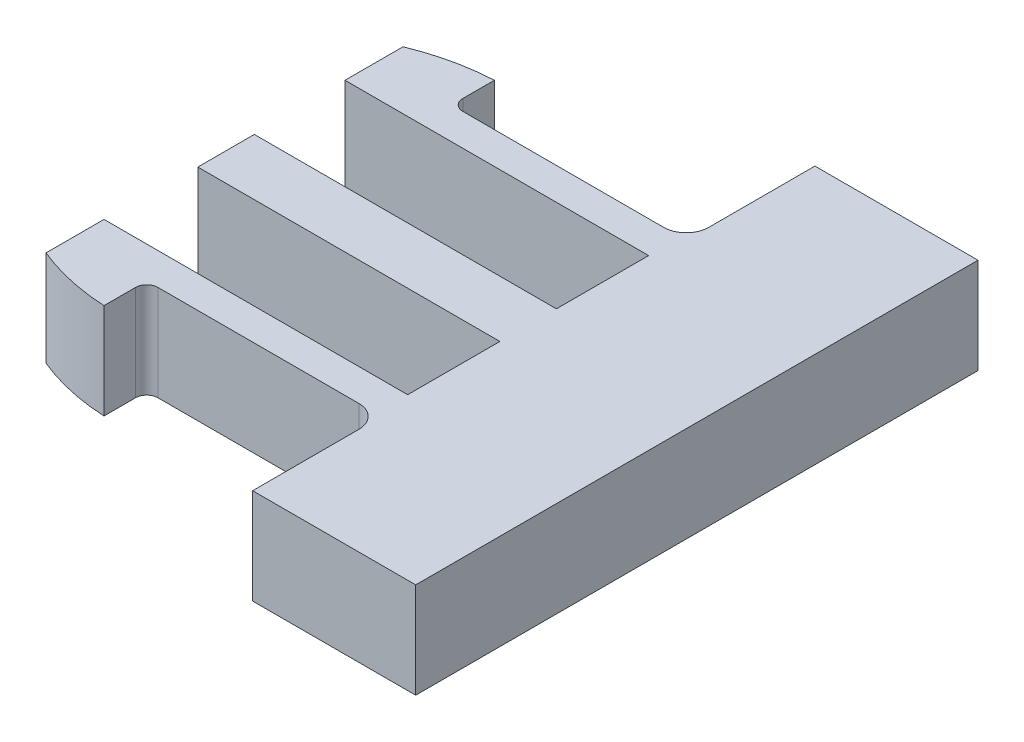
from build123d import *

# Parameters (mm, degrees)
SALIENTE_EXTRUIR1_DEPTH = 8.5
REDONDEO1_R             = 2
CORTAR_EXTRUIR1_START   = -10
CORTAR_EXTRUIR1_DEPTH   = 10
CROQUIS3_W              = 2
CROQUIS3_H              = 37.641018094
CORTAR_EXTRUIR2_DEPTH   = 10
CROQUIS4_W              = 20.360825868
CROQUIS4_H              = 3.8
CORTAR_EXTRUIR3_DEPTH   = 10
REDONDEO2_R             = 1
REDONDEO3_R             = 2
CORTAR_EXTRUIR4_DEPTH   = 10
CORTAR_EXTRUIR5_DEPTH   = 10
REDONDEO4_R             = 2
CROQUIS9_W              = 0.360825868
CROQUIS9_H              = 41.677341087
CORTAR_EXTRUIR6_DEPTH   = 10
CROQUIS10_W             = 14.5
CROQUIS10_H             = 0.285488866
SALIENTE_EXTRUIR2_DEPTH = 8.5


with BuildPart() as part:
    # Croquis1 → Saliente-Extruir1 (new body)
    with BuildSketch(Plane(origin=(0, 0, 0), x_dir=(1, 0, 0), z_dir=(0, 1, 0))):
        with BuildLine():
            Line((13.270197773, -14.714511134), (13.270197773, -24.714511134))
            Line((13.270197773, -24.714511134), (28.270197773, -24.714511134))
            Line((28.270197773, -24.714511134), (28.270197773, 24.714511134))
            Line((28.270197773, 24.714511134), (13.270197773, 24.714511134))
            Line((13.270197773, 24.714511134), (13.270197773, 14.714511134))
            Line((13.270197773, 14.714511134), (-6.590628095, 14.714511134))
            ThreePointArc((-6.590628095, 14.714511134), (-6.944181486, 14.860957744), (-7.090628095, 15.214511134))
            Line((-7.090628095, 15.214511134), (-7.090628095, 18.995462915))
            ThreePointArc((-7.090628095, 18.995462915), (-7.383521314, 19.702569696), (-8.090628095, 19.995462915))
            ThreePointArc((-8.090628095, 19.995462915), (-12.706365951, 18.287755027), (-16.090628095, 14.714511134))
            Line((-16.090628095, 14.714511134), (-16.090628095, 10.714511134))
            Line((-16.090628095, 10.714511134), (13.270197773, 10.714511134))
            Line((13.270197773, 10.714511134), (13.270197773, 8.214511134))
            Line((13.270197773, 8.214511134), (13.270197773, 5.212235466))
            Line((13.270197773, 5.212235466), (13.270197773, 5.012235466))
            Line((13.270197773, 5.012235466), (13.270197773, 3.012235466))
            Line((13.270197773, 3.012235466), (-16.090628095, 3.012235466))
            Line((-16.090628095, 3.012235466), (-16.090628095, -3.012235466))
            Line((-16.090628095, -3.012235466), (13.270197773, -3.012235466))
            Line((13.270197773, -3.012235466), (13.270197773, -5.012235466))
            Line((13.270197773, -5.012235466), (13.270197773, -5.212235466))
            Line((13.270197773, -5.212235466), (13.270197773, -8.214511134))
            Line((13.270197773, -8.214511134), (13.270197773, -10.714511134))
            Line((13.270197773, -10.714511134), (-16.090628095, -10.714511134))
            Line((-16.090628095, -10.714511134), (-16.090628095, -14.714511134))
            ThreePointArc((-16.090628095, -14.714511134), (-12.706365951, -18.287755027), (-8.090628095, -19.995462915))
            ThreePointArc((-8.090628095, -19.995462915), (-7.383521314, -19.702569696), (-7.090628095, -18.995462915))
            Line((-7.090628095, -18.995462915), (-7.090628095, -14.714511134))
            Line((-7.090628095, -14.714511134), (13.270197773, -14.714511134))
        make_face()
    extrude(amount=SALIENTE_EXTRUIR1_DEPTH)

    # Redondeo1
    redondeo1_edges = [part.edges().sort_by_distance(p)[0] for p in [
        (13.270197773, 4.25, -14.714511134),
        (13.270197773, 4.25, 14.714511134),
    ]]
    fillet(redondeo1_edges, radius=REDONDEO1_R)

    # Croquis2 → Cortar-Extruir1 (cut)
    with BuildSketch(Plane(origin=(0, 8.5, 0), x_dir=(1, 0, 0), z_dir=(0, 1, 0)).offset(CORTAR_EXTRUIR1_START)):
        with BuildLine():
            Line((-7.090628095, 18.995462915), (-7.090628095, 17.354987025))
            ThreePointArc((-7.090628095, 17.354987025), (-11.747603416, 16.569795769), (-16.090628095, 14.714511134))
            ThreePointArc((-16.090628095, 14.714511134), (-12.706365951, 18.287755027), (-8.090628095, 19.995462915))
            ThreePointArc((-8.090628095, 19.995462915), (-7.383521314, 19.702569696), (-7.090628095, 18.995462915))
        make_face()
        with BuildLine():
            Line((-7.090628095, -18.995462915), (-7.090628095, -17.354987025))
            ThreePointArc((-7.090628095, -17.354987025), (-11.747603416, -16.569795769), (-16.090628095, -14.714511134))
            ThreePointArc((-16.090628095, -14.714511134), (-12.706365951, -18.287755027), (-8.090628095, -19.995462915))
            ThreePointArc((-8.090628095, -19.995462915), (-7.383521314, -19.702569696), (-7.090628095, -18.995462915))
        make_face()
    extrude(amount=CORTAR_EXTRUIR1_DEPTH, mode=Mode.SUBTRACT)

    # Croquis3 → Cortar-Extruir2 (cut)
    with BuildSketch(Plane(origin=(0, 8.5, 0), x_dir=(1, 0, 0), z_dir=(0, 1, 0))):
        with Locations((-15.090628095, -0.838537532)):
            Rectangle(CROQUIS3_W, CROQUIS3_H)
    extrude(amount=-CORTAR_EXTRUIR2_DEPTH, mode=Mode.SUBTRACT)

    # Croquis4 → Cortar-Extruir3 (cut)
    with BuildSketch(Plane(origin=(0, 8.5, 0), x_dir=(1, 0, 0), z_dir=(0, 1, 0))):
        with Locations((3.089784839, 15.454987025)):
            Rectangle(CROQUIS4_W, CROQUIS4_H)
        with Locations((3.089784839, -15.454987025)):
            Rectangle(CROQUIS4_W, CROQUIS4_H)
    extrude(amount=-CORTAR_EXTRUIR3_DEPTH, mode=Mode.SUBTRACT)

    # Redondeo2
    redondeo2_edges = [part.edges().sort_by_distance(p)[0] for p in [
        (-7.090628095, 4.25, -13.554987025),
        (-7.090628095, 4.25, 13.554987025),
    ]]
    fillet(redondeo2_edges, radius=REDONDEO2_R)

    # Redondeo3
    redondeo3_edges = [part.edges().sort_by_distance(p)[0] for p in [
        (13.270197773, 4.25, -13.554987025),
        (13.270197773, 4.25, 13.554987025),
    ]]
    fillet(redondeo3_edges, radius=REDONDEO3_R)

    # Croquis6 → Cortar-Extruir4 (cut)
    with BuildSketch(Plane(origin=(0, 8.5, 0), x_dir=(1, 0, 0), z_dir=(0, 1, 0))):
        Polygon((-14.090628095, -3.012235466), (13.270197773, -3.012235466), (13.270197773, -2.512235466), (-13.590628095, -2.512235466), (-13.590628095, 2.512235466), (13.270197773, 2.512235466), (13.270197773, 3.012235466), (-14.090628095, 3.012235466), align=None)
    extrude(amount=-CORTAR_EXTRUIR4_DEPTH, mode=Mode.SUBTRACT)

    # Croquis7 → Cortar-Extruir5 (cut)
    with BuildSketch(Plane(origin=(0, 8.5, 0), x_dir=(1, 0, 0), z_dir=(0, 1, 0))):
        Polygon((13.270197773, 24.714511134), (13.770197773, 24.714511134), (13.770197773, 13.554987025), (13.270197773, 13.554987025), (10.850472816, 13.554987025), (10.850472816, 24.714511134), align=None)
        Polygon((13.270197773, -24.714511134), (10.850472816, -24.714511134), (10.850472816, -13.554987025), (13.270197773, -13.554987025), (13.770197773, -13.554987025), (13.770197773, -24.714511134), align=None)
    extrude(amount=-CORTAR_EXTRUIR5_DEPTH, mode=Mode.SUBTRACT)

    # Redondeo4
    redondeo4_edges = [part.edges().sort_by_distance(p)[0] for p in [
        (13.770197773, 4.25, -13.554987025),
        (13.770197773, 4.25, 13.554987025),
    ]]
    fillet(redondeo4_edges, radius=REDONDEO4_R)

    # Croquis9 → Cortar-Extruir6 (cut)
    with BuildSketch(Plane(origin=(0, 8.5, 0), x_dir=(1, 0, 0), z_dir=(0, 1, 0))):
        with Locations((-13.910215161, 4.161329456)):
            Rectangle(CROQUIS9_W, CROQUIS9_H)
    extrude(amount=-CORTAR_EXTRUIR6_DEPTH, mode=Mode.SUBTRACT)

    # Croquis10 → Saliente-Extruir2 (add)
    with BuildSketch(Plane(origin=(0, 8.5, 0), x_dir=(1, 0, 0), z_dir=(0, 1, 0))):
        with Locations((21.020197773, 24.857255567)):
            Rectangle(CROQUIS10_W, CROQUIS10_H)
        with Locations((21.020197773, -24.857255567)):
            Rectangle(CROQUIS10_W, CROQUIS10_H)
    extrude(amount=-SALIENTE_EXTRUIR2_DEPTH)


solid = part.part
